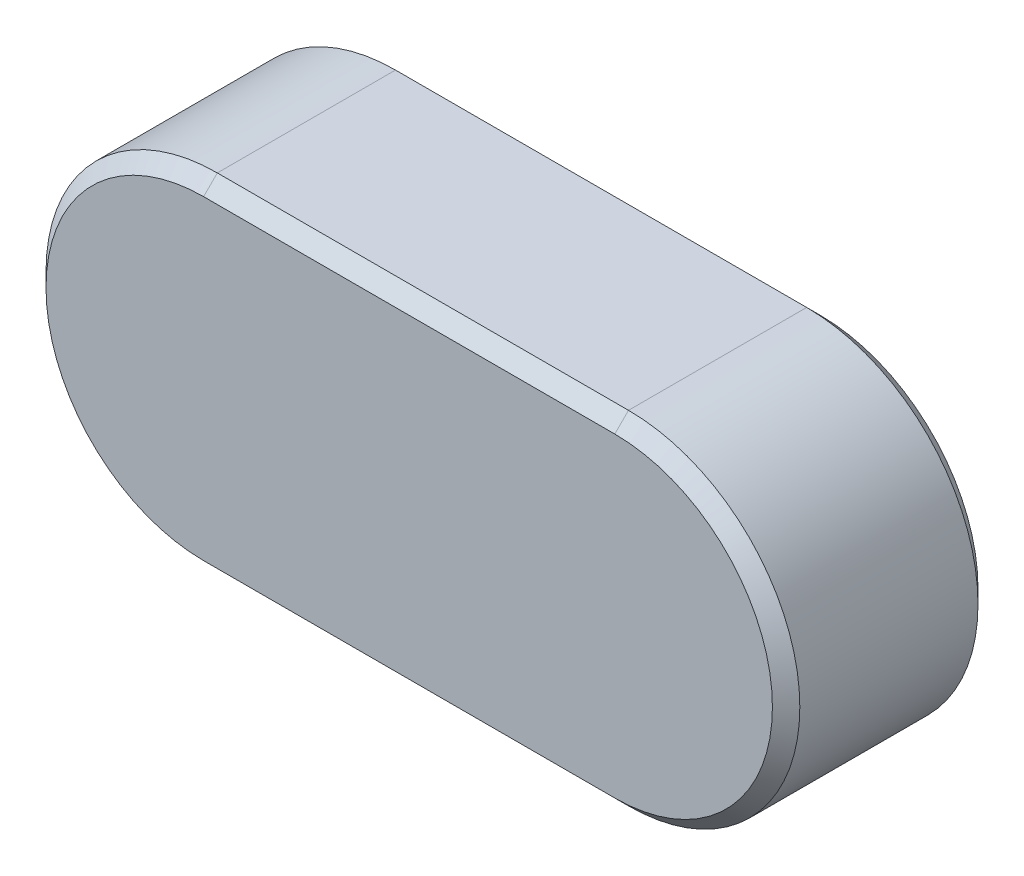
from build123d import *

# Parameters (mm, degrees)
EXTRUDE1_DEPTH = 6
CHAMFER1_SIZE  = 0.4


with BuildPart() as part:
    # Sketch1 → Extrude1 (new body)
    with BuildSketch(Plane.XY):
        with BuildLine():
            Line((0, 5), (-12, 5))
            ThreePointArc((-12, 5), (-17, 0), (-12, -5))
            Line((-12, -5), (0, -5))
            ThreePointArc((0, -5), (5, 0), (0, 5))
        make_face()
    extrude(amount=EXTRUDE1_DEPTH)

    # Chamfer1
    chamfer1_edges = [part.edges().sort_by_distance(p)[0] for p in [
        (-17, 0, 6),
        (-6, -5, 6),
        (5, 0, 6),
        (-6, -5, 0),
        (-17, 0, 0),
        (-6, 5, 0),
        (5, 0, 0),
        (-6, 5, 6),
    ]]
    chamfer(chamfer1_edges, length=CHAMFER1_SIZE)


solid = part.part
